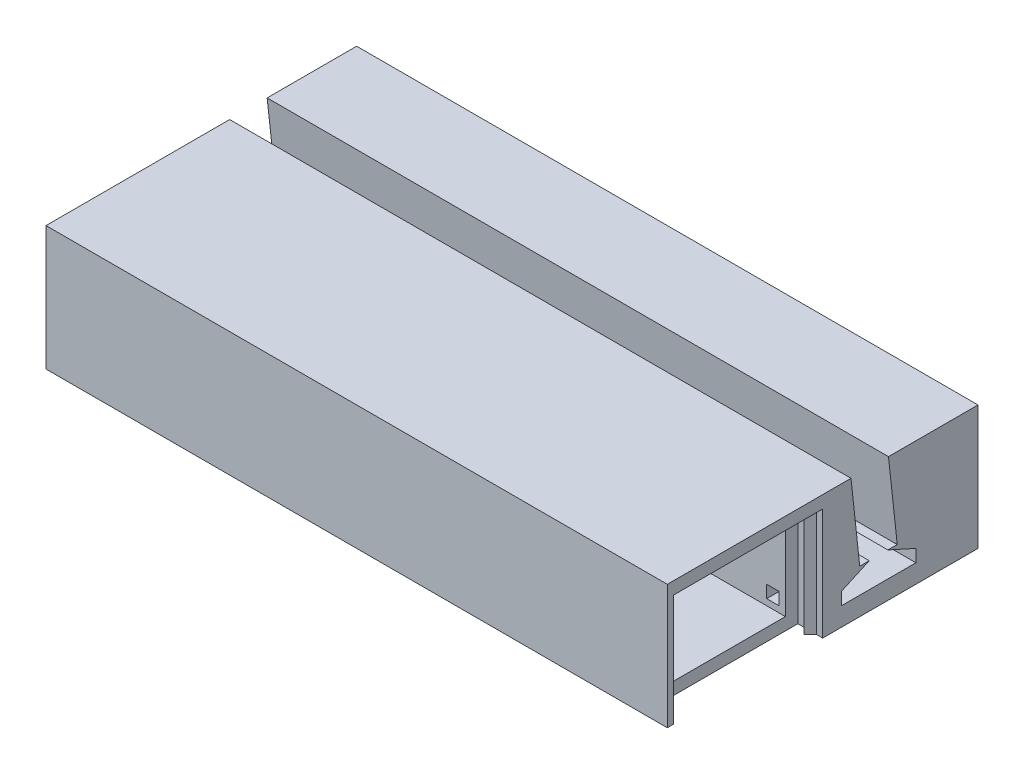
from build123d import *

# Parameters (mm, degrees)
P_IDAT_VYSUNUT_M2_DEPTH  = 100
ODEBRAT_START            = -1.2
SKICA3_W                 = 20
SKICA3_H                 = 12
ODEBRAT_VYSUNUT_M1_DEPTH = 98
SKICA4_W                 = 13.4
SKICA4_H                 = 5.6
ODEBRAT_VYSUNUT_M2_DEPTH = 95
SKICA5_W                 = 2
SKICA5_H                 = 2
ODEBRAT_VYSUNUT_M3_DEPTH = 9
ODEBRAT_VYSUNUT_M6_DEPTH = 98
ODEBRAT_VYSUNUT_M8_DEPTH = 18


with BuildPart() as part:
    # Skica2 → Přidat vysunutím2 (new body)
    with BuildSketch(Plane(origin=(0, 0, 0), x_dir=(0, 0, -1), z_dir=(1, 0, 0))):
        Polygon((4.558367755, 10), (-25, 10), (-25, -10), (25, -10), (25, 10), (10.59358807, 10), (12, -2.961048892), (10.5, -2.961048892), (15, -5), (15, -7), (3, -7), (3, -5), (7.5, -2.961048892), (5.964779685, -2.961048892), align=None)
    extrude(amount=P_IDAT_VYSUNUT_M2_DEPTH)

    # Skica3 → Odebrat vysunutím1 (cut)
    with BuildSketch(Plane(origin=(100, 0, 0), x_dir=(0, 0, -1), z_dir=(1, 0, 0)).offset(ODEBRAT_START)):
        with Locations((-12, -2)):
            Rectangle(SKICA3_W, SKICA3_H)
    extrude(amount=-ODEBRAT_VYSUNUT_M1_DEPTH, mode=Mode.SUBTRACT)

    # Skica4 → Odebrat vysunutím2 (cut)
    with BuildSketch(Plane.ZY):
        with Locations((12.3, -4.2)):
            Rectangle(SKICA4_W, SKICA4_H)
    extrude(amount=-ODEBRAT_VYSUNUT_M2_DEPTH, mode=Mode.SUBTRACT)

    # Skica5 → Odebrat vysunutím3 (cut)
    with BuildSketch(Plane(origin=(0, 0, -3), x_dir=(-1, 0, 0), z_dir=(0, 0, -1))):
        with Locations((-94, -6)):
            Rectangle(SKICA5_W, SKICA5_H)
    extrude(amount=-ODEBRAT_VYSUNUT_M3_DEPTH, mode=Mode.SUBTRACT)

    # Skica10 → Odebrat vysunutím6 (cut)
    with BuildSketch(Plane(origin=(100, 0, 0), x_dir=(0, 0, -1), z_dir=(1, 0, 0)).offset(ODEBRAT_START)):
        with BuildLine():
            Line((-22, 4), (-2, 4))
            ThreePointArc((-2, 4), (-12, 7.510004003), (-22, 4))
        make_face()
    extrude(amount=-ODEBRAT_VYSUNUT_M6_DEPTH, mode=Mode.SUBTRACT)

    # Skica17 → Odebrat vysunutím8 (cut)
    with BuildSketch(Plane.XZ.offset(10)):
        Polygon((98, 12), (96, 12), (96, 0), (97, 0), (98, 1), align=None)
        Polygon((100, 0), (98, 12), (98, 1), (99, 0), align=None)
        Polygon((100, 12), (98, 12), (100, 0), align=None)
        Polygon((98, 23), (98, 12), (100, 12), (100, 24), (99, 24), align=None)
        Polygon((98, 12), (96, 24), (96, 12), align=None)
        Polygon((97, 24), (96, 24), (98, 12), (98, 23), align=None)
    extrude(amount=-ODEBRAT_VYSUNUT_M8_DEPTH, mode=Mode.SUBTRACT)


solid = part.part
